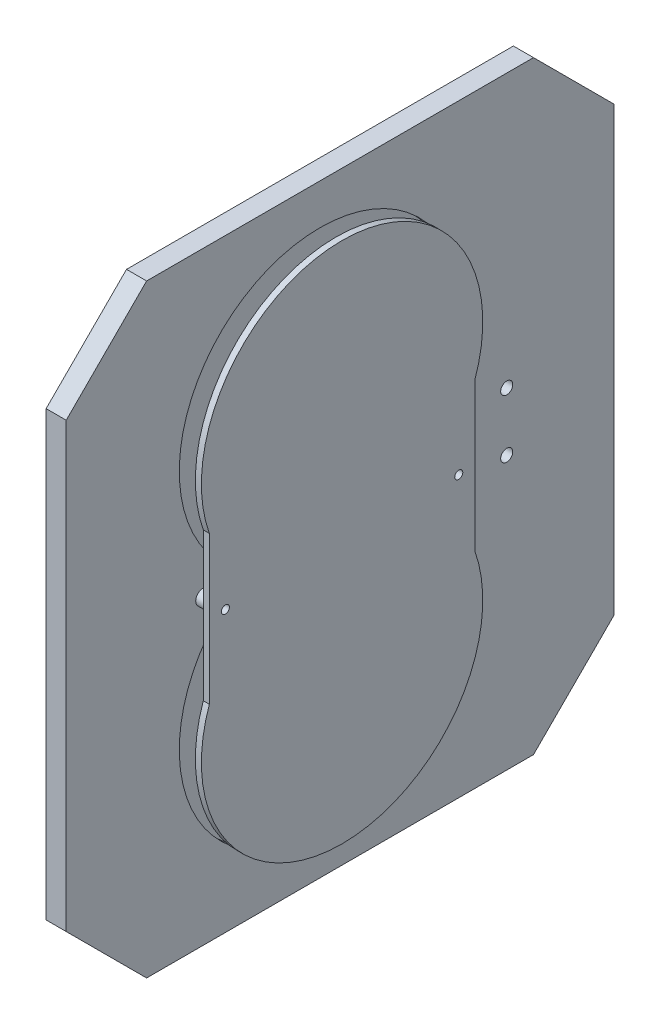
from build123d import *

# Parameters (mm, degrees)
BOSS_EXTRUDE1_DEPTH      = 4
BOSS_EXTRUDE1_DEPTH_BACK = 1
SKETCH1_R                = 1.5
CUT_EXTRUDE2_DEPTH       = 122.350119937
BOSS_EXTRUDE2_START      = -5
BOSS_EXTRUDE2_DEPTH      = 3
SKETCH10_R               = 9
SKETCH10_R_2             = 3
CUT_EXTRUDE3_DEPTH       = 3
SKETCH11_R               = 1.886589546
SKETCH11_R_2             = 1
SKETCH11_R_3             = 2
BOSS_EXTRUDE3_DEPTH      = 4
SKETCH12_R               = 1
BOSS_EXTRUDE4_DEPTH      = 1.5


with BuildPart() as part:
    # Sketch1 → Boss-Extrude1 (new, two sides: drawn at the far end of the back side and taken through both)
    with BuildSketch(Plane(origin=(0, 0, 0), x_dir=(0, 0, -1), z_dir=(1, 0, 0)).offset(-BOSS_EXTRUDE1_DEPTH_BACK)):
        Polygon((-75.000724601, -75.086592855), (41.04338169, -75.086592855), (41.04338169, 75.086592855), (-75.000724601, 75.086592855), (-95.199029314, 75.086592855), (-95.199029314, -75.086592855), align=None)
        with Locations((14.384168299, 7.24761685)):
            Circle(SKETCH1_R, mode=Mode.SUBTRACT)
        with Locations((14.384168299, -7.24761685)):
            Circle(SKETCH1_R, mode=Mode.SUBTRACT)
        with BuildLine():
            Line((-55.096951607, 0), (-55.096951607, 2.745063445))
            ThreePointArc((-55.096951607, 2.745063445), (-55.265937152, 3.549666494), (-55.744337674, 4.218303259))
            ThreePointArc((-55.744337674, 4.218303259), (-32.076418352, 64.999999886), (-8.39868917, 4.222124053))
            ThreePointArc((-8.39868917, 4.222124053), (-8.876916854, 3.553557854), (-9.045837474, 2.74910257))
            Line((-9.045837474, 2.74910257), (-9.045837474, 0))
            Line((-9.045837474, 0), (-9.045837474, -2.74910257))
            ThreePointArc((-9.045837474, -2.74910257), (-8.876916854, -3.553557854), (-8.39868917, -4.222124053))
            ThreePointArc((-8.39868917, -4.222124053), (-32.076418352, -64.999999886), (-55.744337674, -4.218303259))
            ThreePointArc((-55.744337674, -4.218303259), (-55.265937152, -3.549666494), (-55.096951607, -2.745063445))
            Line((-55.096951607, -2.745063445), (-55.096951607, 0))
        make_face(mode=Mode.SUBTRACT)
    extrude(amount=BOSS_EXTRUDE1_DEPTH + BOSS_EXTRUDE1_DEPTH_BACK)

    # Sketch8 → Cut-Extrude2 (cut, through all)
    with BuildSketch(Plane(origin=(4, 0, 0), x_dir=(0, 0, -1), z_dir=(1, 0, 0))):
        Polygon((41.04338169, 75.086592855), (41.04338169, 55.086592855), (21.04338169, 75.086592855), align=None)
        Polygon((41.04338169, -75.086592855), (41.04338169, -55.086592855), (21.04338169, -75.086592855), align=None)
        Polygon((-95.199029314, 55.086592855), (-95.199029314, 75.086592855), (-75.199029314, 75.086592855), align=None)
        Polygon((-95.199029314, -55.086592855), (-95.199029314, -75.086592855), (-75.199029314, -75.086592855), align=None)
    extrude(amount=-CUT_EXTRUDE2_DEPTH, mode=Mode.SUBTRACT)

    # Sketch9 → Boss-Extrude2 (add)
    with BuildSketch(Plane(origin=(4, 0, 0), x_dir=(0, 0, -1), z_dir=(1, 0, 0)).offset(BOSS_EXTRUDE2_START)):
        with BuildLine():
            Line((-55.096951607, 0), (-55.096951607, 2.745063445))
            ThreePointArc((-55.096951607, 2.745063445), (-55.265937152, 3.549666494), (-55.744337674, 4.218303259))
            ThreePointArc((-55.744337674, 4.218303259), (-32.076418352, 64.999999886), (-8.39868917, 4.222124053))
            ThreePointArc((-8.39868917, 4.222124053), (-8.876916854, 3.553557854), (-9.045837474, 2.74910257))
            Line((-9.045837474, 2.74910257), (-9.045837474, 0))
            Line((-9.045837474, 0), (-9.045837474, -2.74910257))
            ThreePointArc((-9.045837474, -2.74910257), (-8.876916854, -3.553557854), (-8.39868917, -4.222124053))
            ThreePointArc((-8.39868917, -4.222124053), (-32.076418352, -64.999999886), (-55.744337674, -4.218303259))
            ThreePointArc((-55.744337674, -4.218303259), (-55.265937152, -3.549666494), (-55.096951607, -2.745063445))
            Line((-55.096951607, -2.745063445), (-55.096951607, 0))
        make_face()
    extrude(amount=BOSS_EXTRUDE2_DEPTH)

    # Sketch10 → Cut-Extrude3 (cut)
    with BuildSketch(Plane(origin=(2, 0, 0), x_dir=(0, 0, -1), z_dir=(1, 0, 0))):
        with Locations((-32.073593851, 30)):
            Circle(SKETCH10_R)
        with Locations((-32.073593851, -30)):
            Circle(SKETCH10_R_2)
    extrude(amount=-CUT_EXTRUDE3_DEPTH, mode=Mode.SUBTRACT)

    # Sketch11 → Boss-Extrude3 (add)
    # profile 1 of 2: a face of its own
    with BuildSketch(Plane(origin=(4, 0, 0), x_dir=(0, 0, -1), z_dir=(1, 0, 0))):
        with Locations(Location((-61.096951607, 0, 0), (0, 0, 180))):
            Circle(SKETCH11_R)
        with Locations((-61.096951607, 0)):
            Circle(SKETCH11_R_2, mode=Mode.SUBTRACT)
    # profile 2 of 2: a face of its own
    with BuildSketch(Plane(origin=(4, 0, 0), x_dir=(0, 0, -1), z_dir=(1, 0, 0))):
        with Locations(Location((-3.045837474, 0, 0), (0, 0, 180))):
            Circle(SKETCH11_R_3)
        with Locations((-3.045837474, 0)):
            Circle(SKETCH11_R_2, mode=Mode.SUBTRACT)
    extrude(amount=BOSS_EXTRUDE3_DEPTH)

    # Sketch12 → Boss-Extrude4 (add)
    with BuildSketch(Plane(origin=(8, 0, 0), x_dir=(0, 0, -1), z_dir=(1, 0, 0))):
        with BuildLine():
            Line((-65.096951607, 0), (-65.096951607, 18.404404175))
            ThreePointArc((-65.096951607, 18.404404175), (-32.080235813, 64.99999937), (0.954162526, 18.416938717))
            Line((0.954162526, 18.416938717), (0.954162526, 0))
            Line((0.954162526, 0), (0.954162526, -18.416938717))
            ThreePointArc((0.954162526, -18.416938717), (-32.080235813, -64.99999937), (-65.096951607, -18.404404175))
            Line((-65.096951607, -18.404404175), (-65.096951607, 0))
        make_face()
        with Locations((-61.096951607, 0)):
            Circle(SKETCH12_R, mode=Mode.SUBTRACT)
        with Locations((-3.045837474, 0)):
            Circle(SKETCH12_R, mode=Mode.SUBTRACT)
    extrude(amount=BOSS_EXTRUDE4_DEPTH)


solid = part.part
